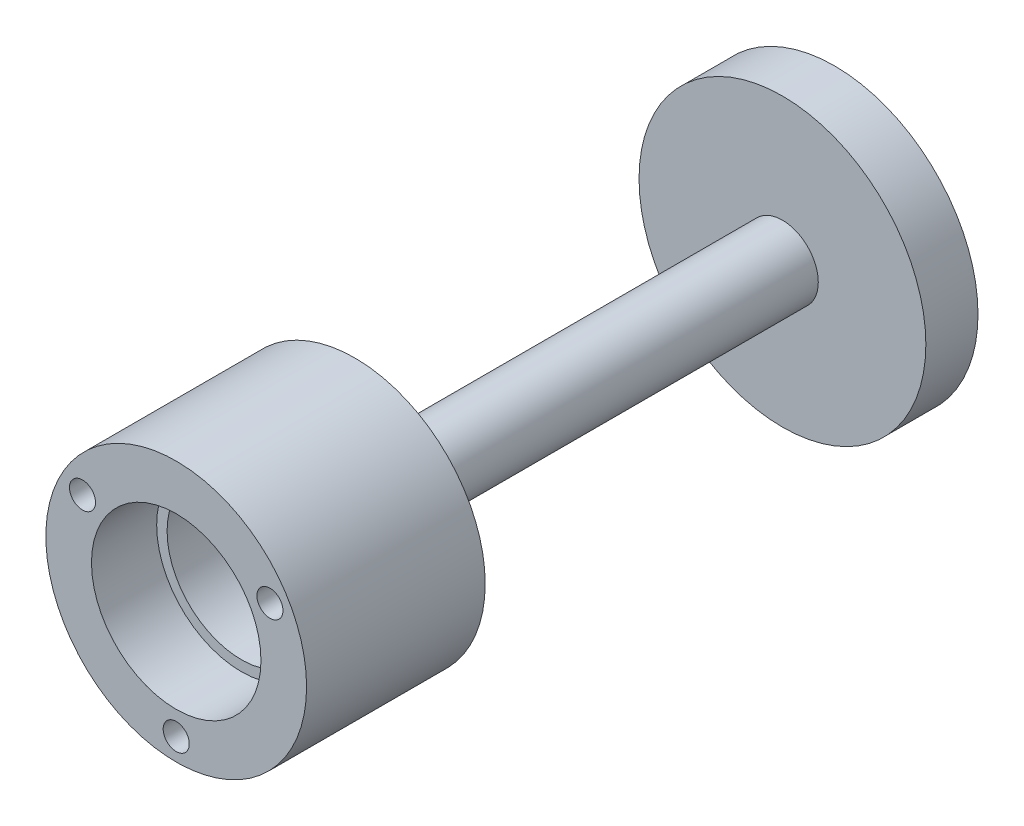
from build123d import *

# Parameters (mm, degrees)
MOUNTING_FLANGE_START                          = -4
SKETCH1_R                                      = 11
MOUNTING_FLANGE_DEPTH                          = 4
SKETCH2_R                                      = 2.75
D5P5_CENTRAL_POST_DEPTH                        = 32.81
CLOSED_FLOOR_BELOW_SHAFT_NOSE_START            = 32.8
SKETCH3_R                                      = 10
CLOSED_FLOOR_BELOW_SHAFT_NOSE_DEPTH            = 2.2
SHAFT_AND_CLIP_CLEARANCE_START                 = 35
SKETCH4_R                                      = 10
SKETCH4_R_2                                    = 5.7
SHAFT_AND_CLIP_CLEARANCE_DEPTH                 = 6.5
LOWER_686ZZ_SEAT_START                         = 41.5
SKETCH5_R                                      = 10
SKETCH5_R_2                                    = 6.5
LOWER_686ZZ_SEAT_DEPTH                         = 5
SKETCH6_R                                      = 1
BASE_THREE_M2_BLIND_THREAD_MAJOR_ENVELOP_DEPTH = 3.6
TOP_CAP_THREE_M2_BLIND_THREAD_MAJOR_ENVE_START = -4.3
SKETCH7_R                                      = 1
TOP_CAP_THREE_M2_BLIND_THREAD_MAJOR_ENVE_DEPTH = 4.3


with BuildPart() as part:
    # Sketch1 → Mounting_Flange (new body)
    with BuildSketch(Plane.XY.offset(MOUNTING_FLANGE_START)):
        Circle(SKETCH1_R)
    extrude(amount=MOUNTING_FLANGE_DEPTH)

    # Sketch2 → D5p5_Central_Post (add)
    with BuildSketch(Plane.XY):
        Circle(SKETCH2_R)
    extrude(amount=D5P5_CENTRAL_POST_DEPTH)

    # Sketch3 → Closed_Floor_Below_Shaft_Nose (add)
    with BuildSketch(Plane.XY.offset(CLOSED_FLOOR_BELOW_SHAFT_NOSE_START)):
        Circle(SKETCH3_R)
    extrude(amount=CLOSED_FLOOR_BELOW_SHAFT_NOSE_DEPTH)

    # Sketch4 → Shaft_And_Clip_Clearance (add)
    with BuildSketch(Plane.XY.offset(SHAFT_AND_CLIP_CLEARANCE_START)):
        Circle(SKETCH4_R)
        with Locations(Location((0, 0, 0), (0, 0, 180))):
            Circle(SKETCH4_R_2, mode=Mode.SUBTRACT)
    extrude(amount=SHAFT_AND_CLIP_CLEARANCE_DEPTH)

    # Sketch5 → Lower_686ZZ_Seat (add)
    with BuildSketch(Plane.XY.offset(LOWER_686ZZ_SEAT_START)):
        Circle(SKETCH5_R)
        Circle(SKETCH5_R_2, mode=Mode.SUBTRACT)
    extrude(amount=LOWER_686ZZ_SEAT_DEPTH)

    # Sketch6 → Base_Three_M2_Blind_Thread_Major_Envelopes (cut)
    with BuildSketch(Plane(origin=(0, 0, -4), x_dir=(-1, 0, 0), z_dir=(0, 0, -1))):
        with Locations((-7.188010851, 4.15)):
            Circle(SKETCH6_R)
        with Locations((7.188010851, 4.15)):
            Circle(SKETCH6_R)
        with Locations((0, -8.3)):
            Circle(SKETCH6_R)
    extrude(amount=-BASE_THREE_M2_BLIND_THREAD_MAJOR_ENVELOP_DEPTH, mode=Mode.SUBTRACT)

    # Sketch7 → Top_Cap_Three_M2_Blind_Thread_Major_Envelopes (cut)
    with BuildSketch(Plane.XY.offset(46.5).offset(TOP_CAP_THREE_M2_BLIND_THREAD_MAJOR_ENVE_START)):
        with Locations(Location((7.188010851, 4.15, 0), (0, 0, 180))):
            Circle(SKETCH7_R)
        with Locations(Location((-7.188010851, 4.15, 0), (0, 0, 180))):
            Circle(SKETCH7_R)
        with Locations(Location((0, -8.3, 0), (0, 0, 180))):
            Circle(SKETCH7_R)
    extrude(amount=TOP_CAP_THREE_M2_BLIND_THREAD_MAJOR_ENVE_DEPTH, mode=Mode.SUBTRACT)


solid = part.part
